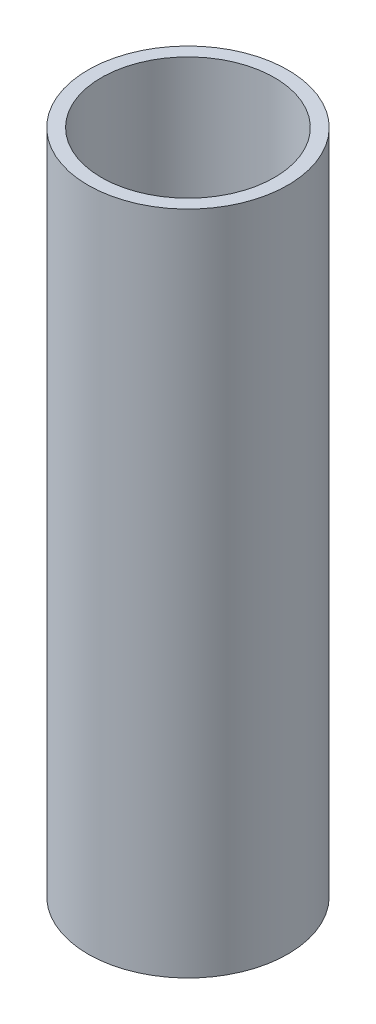
from build123d import *

# Parameters (mm, degrees)
SKETCH1_R           = 15
SKETCH1_R_2         = 13
BOSS_EXTRUDE1_DEPTH = 100


with BuildPart() as part:
    # Sketch1 → Boss-Extrude1 (new body)
    with BuildSketch(Plane(origin=(0, 0, 0), x_dir=(1, 0, 0), z_dir=(0, 1, 0))):
        with Locations(Location((0, 0, 0), (0, 0, 270))):
            Circle(SKETCH1_R)
        with Locations(Location((0, 0, 0), (0, 0, 270))):
            Circle(SKETCH1_R_2, mode=Mode.SUBTRACT)
    extrude(amount=BOSS_EXTRUDE1_DEPTH)


solid = part.part
